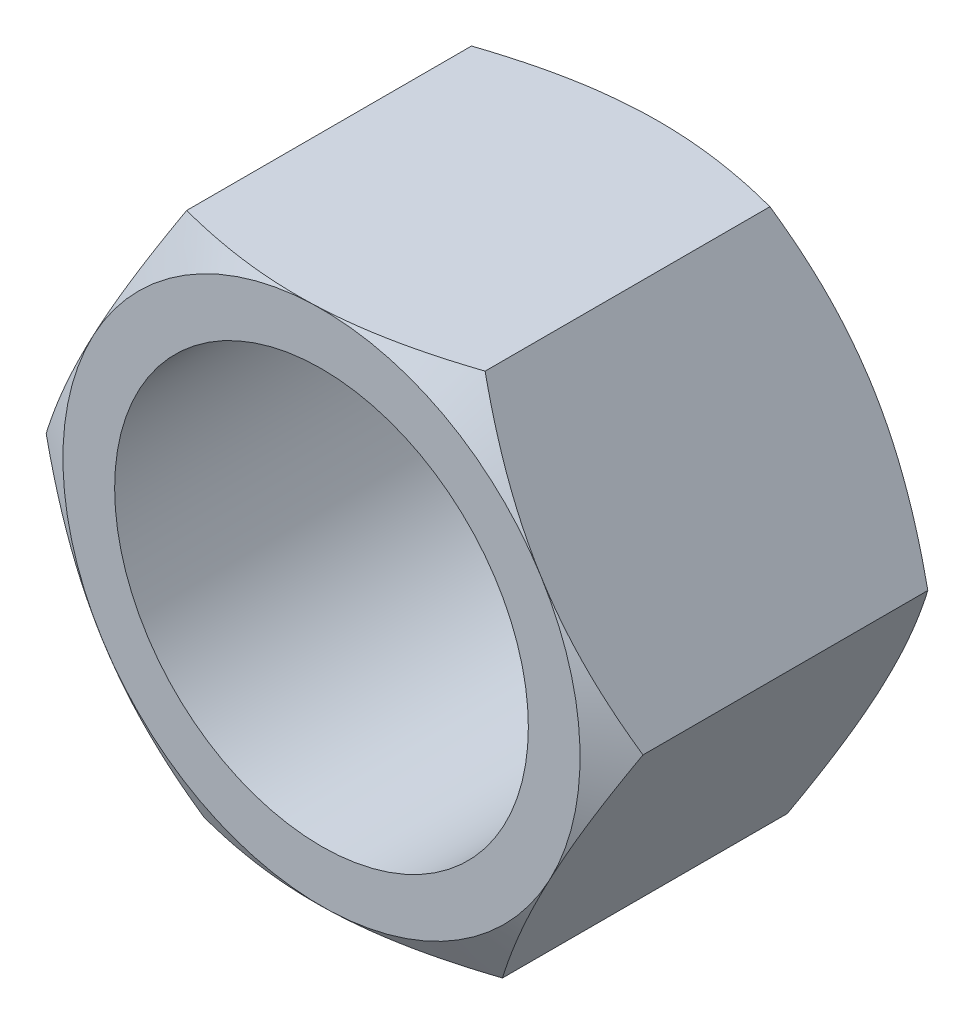
from build123d import *

# Parameters (mm, degrees)
SKETCH1_R           = 5
BOSS_EXTRUDE1_DEPTH = 8
SKETCH2_OUTSIDE_W   = 67.404
SKETCH2_OUTSIDE_H   = 65.714
SKETCH2_OUTSIDE_R   = 6.25
CUT_EXTRUDE1_DEPTH  = 13.512942035
CUT_EXTRUDE1_DRAFT  = -60
SKETCH3_OUTSIDE_W   = 67.404
SKETCH3_OUTSIDE_H   = 65.714
SKETCH3_OUTSIDE_R   = 6.251224569
CUT_EXTRUDE2_DEPTH  = 13.512942035
CUT_EXTRUDE2_DRAFT  = -60


with BuildPart() as part:
    # Sketch1 → Boss-Extrude1 (new body)
    with BuildSketch(Plane.XY):
        Polygon((3.396178054, 6.367833851), (-3.816616855, 6.125093396), (-7.212794909, -0.242740455), (-3.396178054, -6.367833851), (3.816616855, -6.125093396), (7.212794909, 0.242740455), align=None)
        Circle(SKETCH1_R, mode=Mode.SUBTRACT)
    extrude(amount=BOSS_EXTRUDE1_DEPTH)


with BuildPart() as cut_extrude1_tool:
    # Sketch2 outside → Cut-Extrude1 (with draft: the straight prism first)
    with BuildSketch(Plane.XY.offset(8)):
        Rectangle(SKETCH2_OUTSIDE_W, SKETCH2_OUTSIDE_H)
        Circle(SKETCH2_OUTSIDE_R, mode=Mode.SUBTRACT)
    extrude(amount=-CUT_EXTRUDE1_DEPTH)
    # Cut-Extrude1: the draft: its side faces are tilted about the plane it starts from
    cut_extrude1_sides = [cut_extrude1_tool.faces().sort_by_distance(p)[0] for p in [
        (0, -32.857, 1.243528983),
        (33.702, 0, 1.243528983),
        (0, 32.857, 1.243528983),
        (-33.702, 0, 1.243528983),
        (-6.25, 0, 1.243528983),
    ]]
    draft(cut_extrude1_sides, Plane.XY.offset(8), CUT_EXTRUDE1_DRAFT)


with BuildPart() as part_1:
    add(part.part)

    # Cut-Extrude1: cut by cut_extrude1_tool
    add(cut_extrude1_tool.part, mode=Mode.SUBTRACT)


with BuildPart() as cut_extrude2_tool:
    # Sketch3 outside → Cut-Extrude2 (with draft: the straight prism first)
    with BuildSketch(Plane(origin=(0, 0, 0), x_dir=(-1, 0, 0), z_dir=(0, 0, -1))):
        Rectangle(SKETCH3_OUTSIDE_W, SKETCH3_OUTSIDE_H)
        Circle(SKETCH3_OUTSIDE_R, mode=Mode.SUBTRACT)
    extrude(amount=-CUT_EXTRUDE2_DEPTH)
    # Cut-Extrude2: the draft: its side faces are tilted about the plane it starts from
    cut_extrude2_sides = [cut_extrude2_tool.faces().sort_by_distance(p)[0] for p in [
        (0, -32.857, 6.756471017),
        (-33.702, 0, 6.756471017),
        (0, 32.857, 6.756471017),
        (33.702, 0, 6.756471017),
        (6.251224569, 0, 6.756471017),
    ]]
    draft(cut_extrude2_sides, Plane(origin=(0, 0, 0), x_dir=(-1, 0, 0), z_dir=(0, 0, -1)), CUT_EXTRUDE2_DRAFT)


with BuildPart() as part_2:
    add(part_1.part)

    # Cut-Extrude2: cut by cut_extrude2_tool
    add(cut_extrude2_tool.part, mode=Mode.SUBTRACT)


solid = part_2.part
